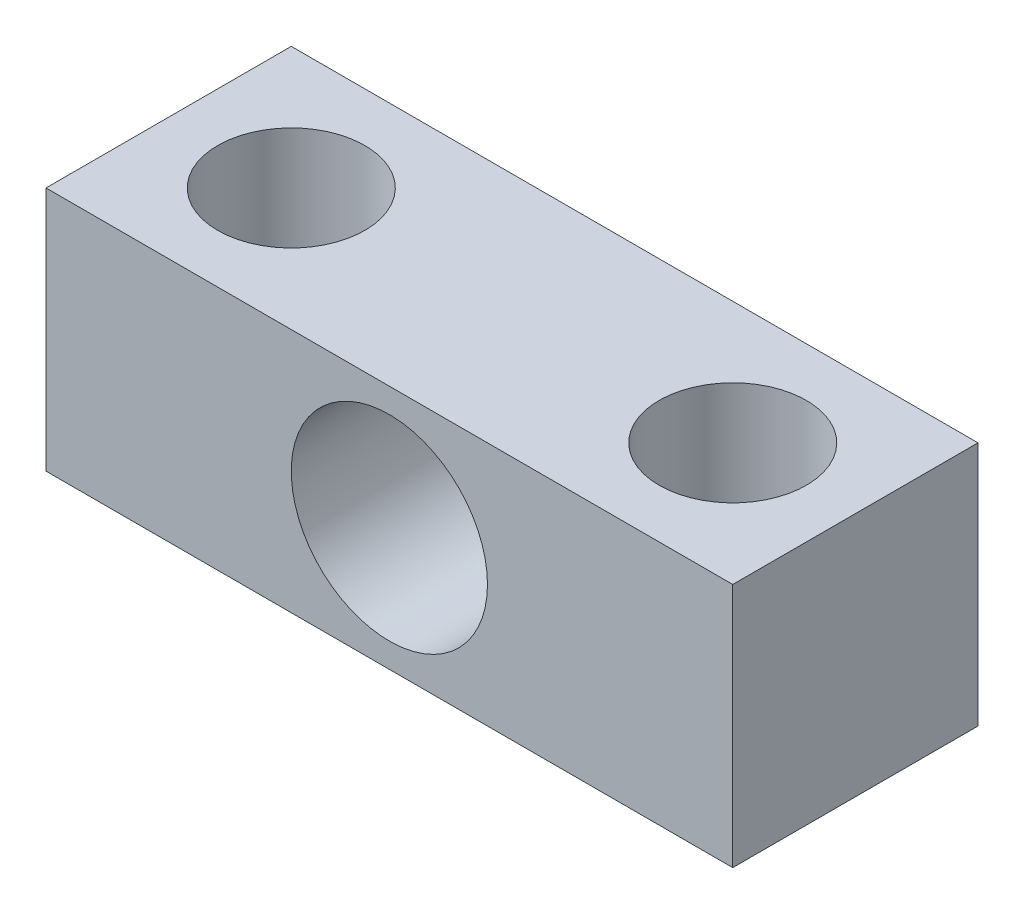
from build123d import *

# Parameters (mm, degrees)
ESQUISSE1_W      = 28
ESQUISSE1_H      = 10
EXTRUSION1_DEPTH = 10
ESQUISSE2_R      = 4
EXTRUSION2_DEPTH = 32.368774283
ESQUISSE3_R      = 3
EXTRUSION3_DEPTH = 32.368774283


with BuildPart() as part:
    # Esquisse1 → Extrusion1 (new body)
    with BuildSketch(Plane(origin=(0, 0, 0), x_dir=(1, 0, 0), z_dir=(0, 1, 0))):
        with Locations((14, 5)):
            Rectangle(ESQUISSE1_W, ESQUISSE1_H)
    extrude(amount=EXTRUSION1_DEPTH)

    # Esquisse2 → Extrusion2 (cut, through all)
    with BuildSketch(Plane.XY):
        with Locations((14, 5)):
            Circle(ESQUISSE2_R)
    extrude(amount=-EXTRUSION2_DEPTH, mode=Mode.SUBTRACT)

    # Esquisse3 → Extrusion3 (cut, through all)
    with BuildSketch(Plane(origin=(0, 10, 0), x_dir=(1, 0, 0), z_dir=(0, 1, 0))):
        with Locations(Location((5, 5, 0), (0, 0, 270))):
            Circle(ESQUISSE3_R)
        with Locations(Location((23, 5, 0), (0, 0, 270))):
            Circle(ESQUISSE3_R)
    extrude(amount=-EXTRUSION3_DEPTH, mode=Mode.SUBTRACT)


solid = part.part
